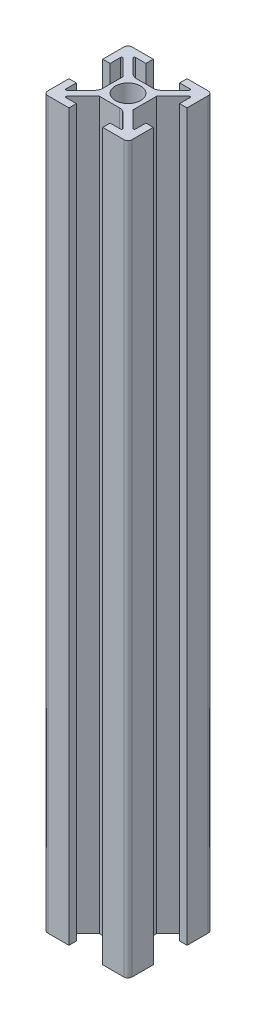
from build123d import *

# Parameters (mm, degrees)
ESBO_O1_W                = 20
ESBO_O1_H                = 20
ESBO_O1_R                = 3
RESSALTO_EXTRUS_O1_DEPTH = 86
ESBO_O2_W                = 8
ESBO_O2_H                = 1.75
CORTE_EXTRUS_O1_DEPTH    = 173.580416038
PADR_OCIRCULAR2_COUNT    = 4
FILETE2_R                = 1
FILETE3_R                = 2
FILETE4_R                = 0.25


with BuildPart() as part:
    # Esboço1 → Ressalto-extrusão1 (new, symmetric)
    with BuildSketch(Plane(origin=(0, 0, 0), x_dir=(1, 0, 0), z_dir=(0, 1, 0))):
        Rectangle(ESBO_O1_W, ESBO_O1_H)
        with Locations(Location((0, 0, 0), (0, 0, 270))):
            Circle(ESBO_O1_R, mode=Mode.SUBTRACT)
    extrude(amount=RESSALTO_EXTRUS_O1_DEPTH, both=True)

    # Esboço2 → Corte-extrusão1 (cut, through all)
    with BuildSketch(Plane(origin=(0, 86, 0), x_dir=(1, 0, 0), z_dir=(0, 1, 0))):
        Polygon((-7.05, 8.25), (-2.8, 4), (2.8, 4), (7.05, 8.25), (4, 8.25), (-4, 8.25), align=None)
        with Locations((0, 9.125)):
            Rectangle(ESBO_O2_W, ESBO_O2_H)
    corte_extrus_o1 = extrude(amount=-CORTE_EXTRUS_O1_DEPTH, mode=Mode.SUBTRACT)

    # PadrãoCircular2: Corte-extrusão1 ×4 about axis
    padr_ocircular2_axis = Axis((0, 0, 0), (0, 1, 0))
    for i in range(1, PADR_OCIRCULAR2_COUNT):
        add(corte_extrus_o1.rotate(padr_ocircular2_axis, i * 360 / PADR_OCIRCULAR2_COUNT), mode=Mode.SUBTRACT)

    # Filete2
    filete2_edges = [part.edges().sort_by_distance(p)[0] for p in [
        (10, 0, 10),
        (-10, 0, 10),
        (-10, 0, -10),
        (10, 0, -10),
    ]]
    fillet(filete2_edges, radius=FILETE2_R)

    # Filete3
    filete3_edges = [part.edges().sort_by_distance(p)[0] for p in [
        (-4, 0, 2.8),
        (2.8, 0, -4),
        (-2.8, 0, -4),
        (2.8, 0, 4),
    ]]
    fillet(filete3_edges, radius=FILETE3_R)

    # Filete4
    filete4_edges = [part.edges().sort_by_distance(p)[0] for p in [
        (-8.25, 0, -7.05),
        (-8.25, 0, 7.05),
        (7.05, 0, -8.25),
        (-7.05, 0, -8.25),
        (8.25, 0, 7.05),
        (8.25, 0, -7.05),
        (-7.05, 0, 8.25),
        (7.05, 0, 8.25),
    ]]
    fillet(filete4_edges, radius=FILETE4_R)


solid = part.part
